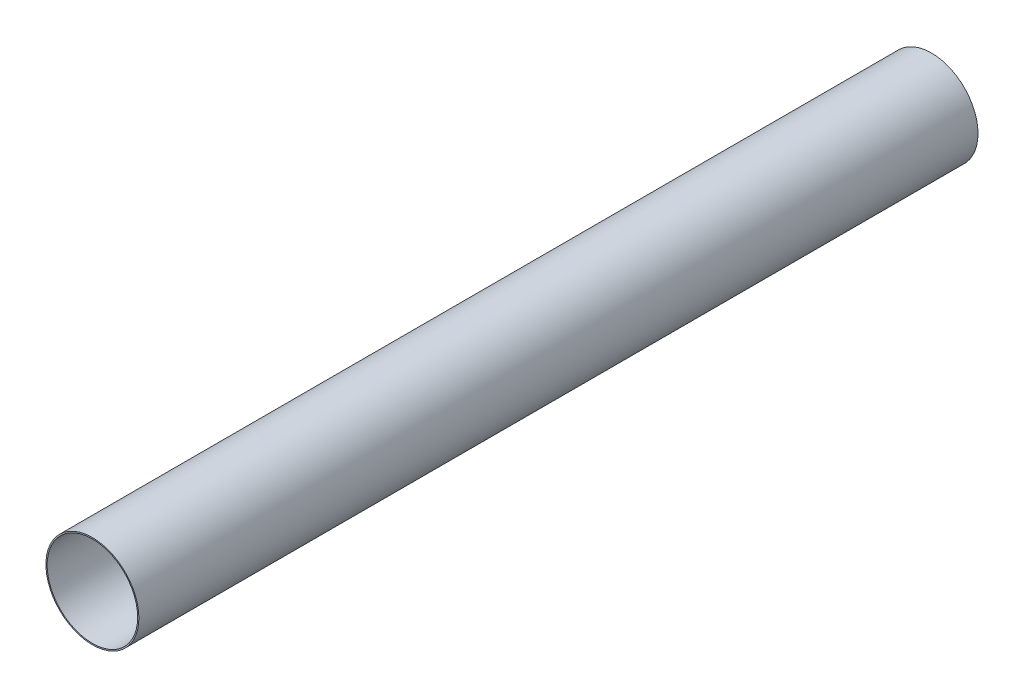
from build123d import *

# Parameters (mm, degrees)
SKETCH1_R      = 21.1074
SKETCH1_R_2    = 20.5486
EXTRUDE1_DEPTH = 381


with BuildPart() as part:
    # Sketch1 → Extrude1 (new body)
    with BuildSketch(Plane.XY):
        Circle(SKETCH1_R)
        Circle(SKETCH1_R_2, mode=Mode.SUBTRACT)
    extrude(amount=EXTRUDE1_DEPTH)


solid = part.part
